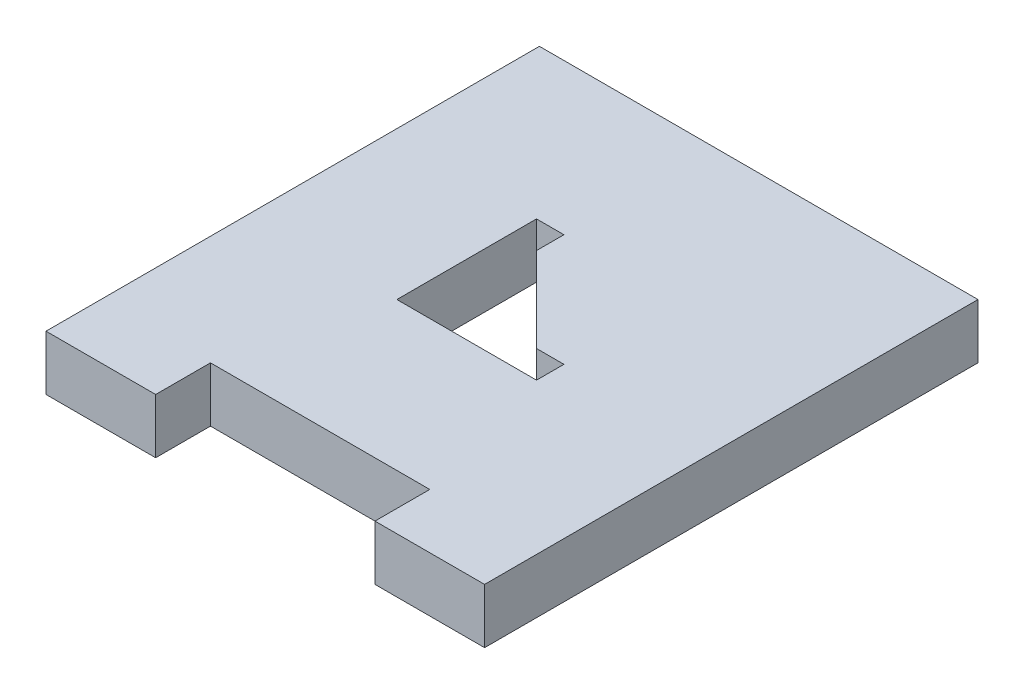
from build123d import *

# Parameters (mm, degrees)
SKETCH1_W           = 25.4
SKETCH1_H           = 25.4
BOSS_EXTRUDE1_DEPTH = 3.175
SKETCH2_W           = 6.35
SKETCH2_H           = 3.175
BOSS_EXTRUDE2_DEPTH = 3.175
CUT_EXTRUDE1_DEPTH  = 6.35


with BuildPart() as part:
    # Sketch1 → Boss-Extrude1 (new body)
    with BuildSketch(Plane(origin=(0, 0, 0), x_dir=(1, 0, 0), z_dir=(0, 1, 0))):
        Rectangle(SKETCH1_W, SKETCH1_H)
        Polygon((-4.1275, -4.1275), (-4.1275, 3.95986), (-2.54, 3.95986), (-2.54, -2.54), (3.95986, -2.54), (3.95986, -4.1275), align=None, mode=Mode.SUBTRACT)
    extrude(amount=BOSS_EXTRUDE1_DEPTH)

    # Sketch2 → Boss-Extrude2 (add)
    with BuildSketch(Plane.XY.offset(12.7)):
        with Locations((-9.525, 1.5875)):
            Rectangle(SKETCH2_W, SKETCH2_H)
        with Locations((9.525, 1.5875)):
            Rectangle(SKETCH2_W, SKETCH2_H)
    extrude(amount=BOSS_EXTRUDE2_DEPTH)

    # Sketch3 → Cut-Extrude1 (cut)
    with BuildSketch(Plane(origin=(0, 3.175, 0), x_dir=(1, 0, 0), z_dir=(0, 1, 0))):
        Polygon((-2.54, 2.37236), (-2.54, -2.54), (2.37236, -2.54), align=None)
    extrude(amount=-CUT_EXTRUDE1_DEPTH, mode=Mode.SUBTRACT)


solid = part.part
